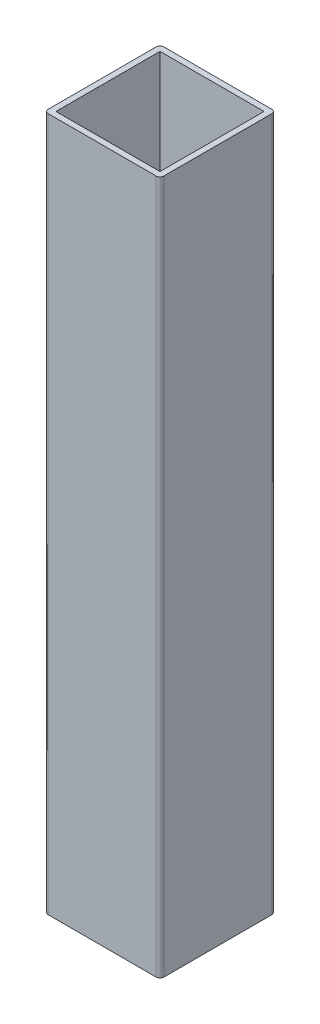
from build123d import *

# Parameters (mm, degrees)
ESBO_O1_W                = 54
ESBO_O1_H                = 54
RESSALTO_EXTRUS_O1_DEPTH = 180


with BuildPart() as part:
    # Esboço1 → Ressalto-extrusão1 (new, symmetric)
    with BuildSketch(Plane(origin=(0, 0, 0), x_dir=(1, 0, 0), z_dir=(0, 1, 0))):
        with BuildLine():
            Line((-28, -30), (28, -30))
            ThreePointArc((28, -30), (29.414213562, -29.414213562), (30, -28))
            Line((30, -28), (30, 28))
            ThreePointArc((30, 28), (29.414213562, 29.414213562), (28, 30))
            Line((28, 30), (-28, 30))
            ThreePointArc((-28, 30), (-29.414213562, 29.414213562), (-30, 28))
            Line((-30, 28), (-30, -28))
            ThreePointArc((-30, -28), (-29.414213562, -29.414213562), (-28, -30))
        make_face()
        Rectangle(ESBO_O1_W, ESBO_O1_H, mode=Mode.SUBTRACT)
    extrude(amount=RESSALTO_EXTRUS_O1_DEPTH, both=True)


solid = part.part
